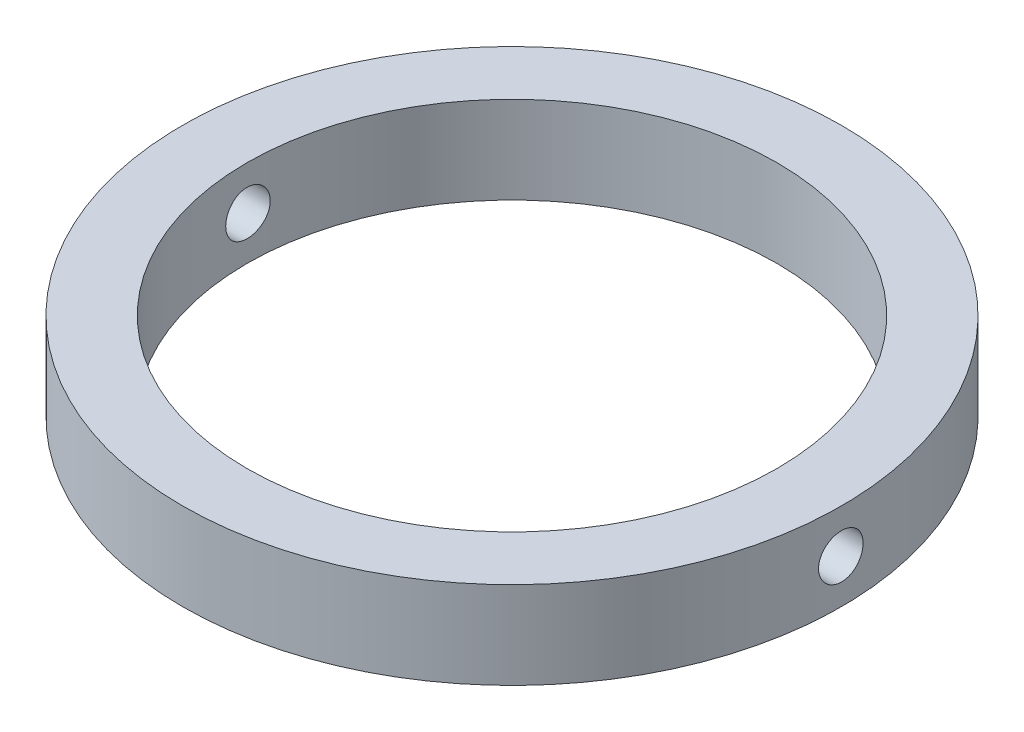
from build123d import *

# Parameters (mm, degrees)
SKETCH1_R           = 37.75
SKETCH1_R_2         = 30.35
BOSS_EXTRUDE1_DEPTH = 10
SKETCH4_R           = 2.55
CUT_EXTRUDE2_DEPTH  = 93


with BuildPart() as part:
    # Sketch1 → Boss-Extrude1 (new body)
    with BuildSketch(Plane(origin=(0, 0, 0), x_dir=(1, 0, 0), z_dir=(0, 1, 0))):
        with Locations(Location((0, 0, 0), (0, 0, 270))):
            Circle(SKETCH1_R)
        with Locations(Location((0, 0, 0), (0, 0, 270))):
            Circle(SKETCH1_R_2, mode=Mode.SUBTRACT)
    extrude(amount=BOSS_EXTRUDE1_DEPTH)

    # Sketch4 → Cut-Extrude2 (cut)
    with BuildSketch(Plane.ZY.offset(37.75)):
        with Locations((0, 5)):
            Circle(SKETCH4_R)
    extrude(amount=-CUT_EXTRUDE2_DEPTH, mode=Mode.SUBTRACT)


solid = part.part
